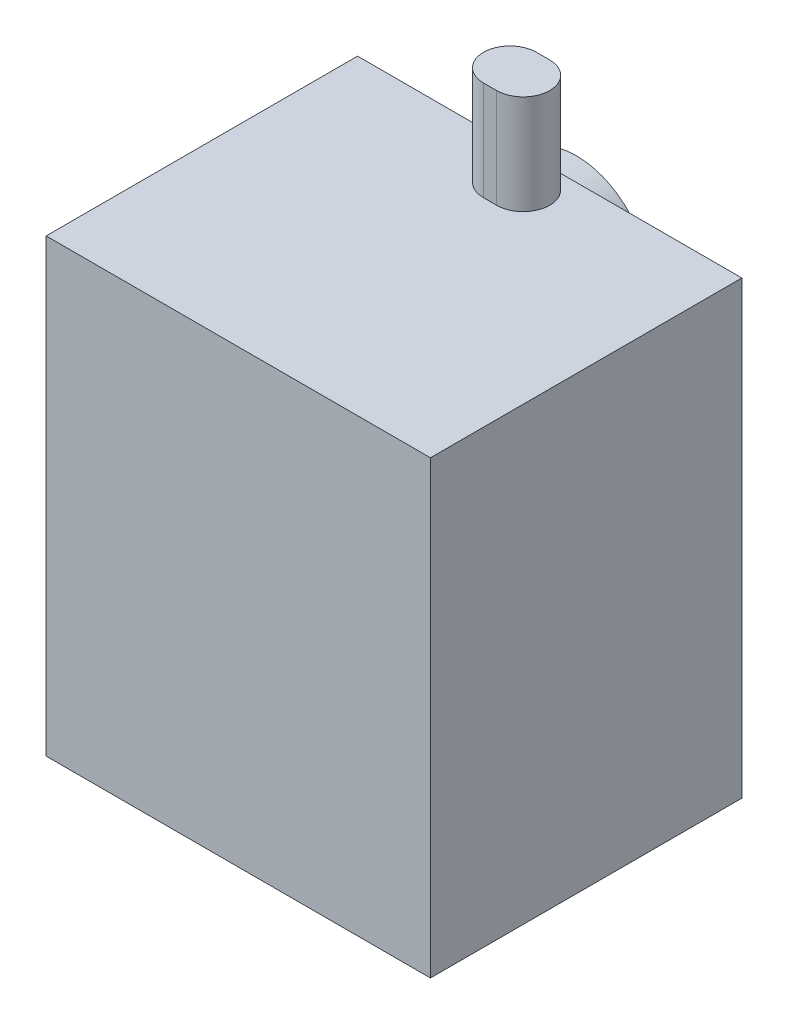
from build123d import *

# Parameters (mm, degrees)
ESBO_O1_W                = 58
ESBO_O1_H                = 68
RESSALTO_EXTRUS_O1_DEPTH = 23.5
ESBO_O2_W                = 2.557692308
ESBO_O2_H                = 0.314102564
CORTE_EXTRUS_O1_DEPTH    = 1
RESSALTO_EXTRUS_O2_DEPTH = 15
ESBO_O4_R                = 11
RESSALTO_EXTRUS_O3_DEPTH = 4


with BuildPart() as part:
    # Esboço1 → Ressalto-extrusão1 (new, symmetric)
    with BuildSketch(Plane.XY):
        Rectangle(ESBO_O1_W, ESBO_O1_H)
    extrude(amount=RESSALTO_EXTRUS_O1_DEPTH, both=True)

    # Esboço2 → Corte-extrusão1 (cut)
    # profile 1 of 13: a face of its own
    with BuildSketch(Plane(origin=(0, 0, -23.5), x_dir=(-1, 0, 0), z_dir=(0, 0, -1))):
        with BuildLine():
            add(Edge.make_bspline(
                [(12.634615385, -15.905649038), (12.63370731, -15.9251371), (12.631929126, -15.963298467), (12.616823357, -16.01853796), (12.590827583, -16.068786757), (12.557084436, -16.114021348), (12.515769317, -16.151518745), (12.46882621, -16.178406374), (12.41772133, -16.195571354), (12.382112539, -16.197656367), (12.363982372, -16.198717949)],
                knots=[0, 0, 0, 0, 1.054986045, 2.065865298, 3.074122704, 4.105114675, 5.109626121, 6.074217918, 7.019490725, 8, 8, 8, 8], degree=3))
            add(Edge.make_bspline(
                [(12.363982372, -16.198717949), (12.346322808, -16.197632619), (12.311411939, -16.19548705), (12.261193153, -16.178419063), (12.214903719, -16.151293324), (12.173669374, -16.114046306), (12.13994572, -16.068780165), (12.113944797, -16.018539704), (12.098840388, -15.963298008), (12.097062016, -15.925136945), (12.096153846, -15.905649038)],
                knots=[0, 0, 0, 0, 0.961106377, 1.899993565, 2.859409042, 3.870007927, 4.90724781, 5.921615355, 6.938620636, 8, 8, 8, 8], degree=3))
            add(Edge.make_bspline(
                [(12.096153846, -15.905649038), (12.097032849, -15.886384955), (12.098743713, -15.848889934), (12.114125508, -15.794666133), (12.139889179, -15.745225857), (12.174136064, -15.700731021), (12.214629537, -15.662745528), (12.261228119, -15.635719875), (12.311403037, -15.618606253), (12.346319817, -15.616466834), (12.363982372, -15.615384615)],
                knots=[0, 0, 0, 0, 1.055304112, 2.054011575, 3.063363921, 4.096942562, 5.122536081, 6.088009498, 7.032825006, 8, 8, 8, 8], degree=3))
            add(Edge.make_bspline(
                [(12.363982372, -15.615384615), (12.382115643, -15.61644297), (12.417730531, -15.618521646), (12.468790647, -15.635733158), (12.516045838, -15.662517326), (12.556618084, -15.700755565), (12.590884, -15.745219432), (12.616642695, -15.794667806), (12.63202579, -15.84888949), (12.633736474, -15.886384804), (12.634615385, -15.905649038)],
                knots=[0, 0, 0, 0, 0.986662878, 1.937868148, 2.908513651, 3.927890639, 4.955204348, 5.958438607, 6.951092507, 8, 8, 8, 8], degree=3))
        make_face()
    # profile 2 of 13: a face of its own
    with BuildSketch(Plane(origin=(0, 0, -23.5), x_dir=(-1, 0, 0), z_dir=(0, 0, -1))):
        with Locations((10.278846154, -15.907051282)):
            Rectangle(ESBO_O2_W, ESBO_O2_H)
    # profile 3 of 13: a face of its own
    with BuildSketch(Plane(origin=(0, 0, -23.5), x_dir=(-1, 0, 0), z_dir=(0, 0, -1))):
        with BuildLine():
            Line((11.557692308, -12.788461538), (11.557692308, -13.102564103))
            Line((11.557692308, -13.102564103), (10.371394231, -13.102564103))
            add(Edge.make_bspline(
                [(10.371394231, -13.102564103), (10.336571482, -13.102706007), (10.269957194, -13.102977465), (10.174102007, -13.104818406), (10.086685294, -13.109148499), (10.007656557, -13.114562324), (9.937029166, -13.12152446), (9.875049809, -13.129807821), (9.821015625, -13.139066242), (9.788472269, -13.148128956), (9.77333734, -13.15234375)],
                knots=[0, 0, 0, 0, 1.388932606, 2.656963016, 3.823490214, 4.879454478, 5.816252168, 6.653371382, 7.373723809, 8, 8, 8, 8], degree=3))
            add(Edge.make_bspline(
                [(9.77333734, -13.15234375), (9.754314522, -13.159105249), (9.716664366, -13.172487678), (9.66227459, -13.196760517), (9.611902173, -13.226791252), (9.563587464, -13.259642176), (9.518825676, -13.297575237), (9.477324454, -13.340035786), (9.438599671, -13.386270157), (9.391894487, -13.453994357), (9.342467449, -13.546574179), (9.299224971, -13.667850836), (9.273761575, -13.799588353), (9.270768951, -13.890745957), (9.269230769, -13.93760016)],
                knots=[0, 0, 0, 0, 0.725930277, 1.436768641, 2.137297926, 2.832005607, 3.535753883, 4.242956221, 4.964984144, 5.701683124, 7.198126434, 8.723945959, 10.316137162, 12, 12, 12, 12], degree=3))
            add(Edge.make_bspline(
                [(9.269230769, -13.93760016), (9.270763206, -13.984460301), (9.273720675, -14.074896264), (9.298840522, -14.205257317), (9.339821483, -14.324642436), (9.397828501, -14.43165769), (9.468546589, -14.525631282), (9.551561506, -14.603933726), (9.644209328, -14.668541486), (9.713333816, -14.696750839), (9.748096955, -14.7109375)],
                knots=[0, 0, 0, 0, 1.157091467, 2.233085092, 3.266839029, 4.264239195, 5.228693433, 6.160074799, 7.074690074, 8, 8, 8, 8], degree=3))
            add(Edge.make_bspline(
                [(9.748096955, -14.7109375), (9.762062957, -14.715134833), (9.792938376, -14.72441411), (9.84532423, -14.734312627), (9.907735501, -14.743598439), (9.980827619, -14.749789197), (10.06395603, -14.756854755), (10.157550626, -14.759294511), (10.261059725, -14.762778608), (10.333529294, -14.762806132), (10.371394231, -14.762820513)],
                knots=[0, 0, 0, 0, 0.557560243, 1.232629526, 2.036798082, 2.970922211, 4.03790722, 5.227863888, 6.551574656, 8, 8, 8, 8], degree=3))
            Line((10.371394231, -14.762820513), (11.557692308, -14.762820513))
            Line((11.557692308, -14.762820513), (11.557692308, -15.076923077))
            Line((11.557692308, -15.076923077), (10.3125, -15.076923077))
            add(Edge.make_bspline(
                [(10.3125, -15.076923077), (10.270192828, -15.076481383), (10.188111126, -15.075624437), (10.068827026, -15.070117079), (9.957664743, -15.060667516), (9.854565649, -15.046324664), (9.759607746, -15.029459552), (9.672671696, -15.007701413), (9.594017487, -14.981729399), (9.522291359, -14.952402962), (9.457190155, -14.917853706), (9.395768795, -14.880834424), (9.338129531, -14.839287899), (9.283989051, -14.793582089), (9.233543731, -14.743922274), (9.187013486, -14.68997668), (9.143574873, -14.632827367), (9.104077801, -14.571478033), (9.068870026, -14.505866026), (9.038173414, -14.436321459), (9.012814759, -14.36233703), (8.992079425, -14.284741521), (8.974909687, -14.202885593), (8.963400657, -14.117122195), (8.956074478, -14.027239019), (8.955448926, -13.966127551), (8.955128205, -13.934795673)],
                knots=[0, 0, 0, 0, 1.492959813, 2.896546261, 4.212934643, 5.4282803, 6.568701279, 7.614836728, 8.587629399, 9.489753423, 10.345563548, 11.185732697, 12.018869657, 12.849922188, 13.68387515, 14.5140269, 15.361852057, 16.215154979, 17.085973896, 17.987004002, 18.894652782, 19.842944701, 20.819888734, 21.843945232, 22.894589698, 24, 24, 24, 24], degree=3))
            add(Edge.make_bspline(
                [(8.955128205, -13.934795673), (8.955467912, -13.903699159), (8.956135468, -13.842591614), (8.963277276, -13.75292037), (8.975085447, -13.666971763), (8.991940664, -13.585051365), (9.012979734, -13.507076968), (9.03798327, -13.432732728), (9.069063751, -13.362889165), (9.104041309, -13.296707161), (9.143606584, -13.234704772), (9.186974624, -13.176596194), (9.234080687, -13.122459342), (9.284728044, -13.072282274), (9.33954498, -13.026769297), (9.398090541, -12.985353256), (9.459784629, -12.94739655), (9.525847792, -12.91304376), (9.598419802, -12.883532004), (9.678716899, -12.857476759), (9.767619415, -12.83616612), (9.865051344, -12.818823652), (9.970546385, -12.804872211), (10.084714801, -12.795186069), (10.207278493, -12.789770238), (10.291928383, -12.788907177), (10.335637019, -12.788461538)],
                knots=[0, 0, 0, 0, 1.083640291, 2.129454052, 3.13281866, 4.105697902, 5.042300162, 5.946461698, 6.836384745, 7.703652036, 8.553297018, 9.397182691, 10.228592656, 11.052265423, 11.879314572, 12.708807002, 13.549817954, 14.402308542, 15.300838682, 16.27712199, 17.341985831, 18.484375296, 19.725102775, 21.0496083, 22.476576903, 24, 24, 24, 24], degree=3))
            Line((10.335637019, -12.788461538), (11.557692308, -12.788461538))
        make_face()
    # profile 4 of 13: a face of its own
    with BuildSketch(Plane(origin=(0, 0, -23.5), x_dir=(-1, 0, 0), z_dir=(0, 0, -1))):
        with BuildLine():
            Line((11.557692308, -12.115384615), (8.057692308, -12.115384615))
            Line((8.057692308, -12.115384615), (8.057692308, -11.801282051))
            Line((8.057692308, -11.801282051), (9.463441506, -11.801282051))
            add(Edge.make_bspline(
                [(9.463441506, -11.801282051), (9.423211384, -11.765819734), (9.344474174, -11.696413932), (9.240732322, -11.581075935), (9.152361198, -11.459568191), (9.08054617, -11.330923449), (9.023460392, -11.196438469), (8.985022756, -11.054831755), (8.958958974, -10.907844169), (8.956415732, -10.807440389), (8.955128205, -10.756610577)],
                knots=[0, 0, 0, 0, 1.06979901, 2.093779087, 3.089483386, 4.062794046, 5.028843981, 5.997762057, 6.986359105, 8, 8, 8, 8], degree=3))
            add(Edge.make_bspline(
                [(8.955128205, -10.756610577), (8.956354374, -10.7114425), (8.958772433, -10.622369053), (8.977537663, -10.491341741), (9.007657479, -10.365242975), (9.049598139, -10.243992389), (9.10494392, -10.128411555), (9.171919959, -10.017849207), (9.25089654, -9.912047311), (9.341535176, -9.813017998), (9.439877501, -9.721710517), (9.545073941, -9.641825694), (9.655679624, -9.574120705), (9.771663464, -9.51847933), (9.892940677, -9.475421117), (10.019428064, -9.445464251), (10.150915158, -9.426719243), (10.240455063, -9.424302408), (10.285857372, -9.423076923)],
                knots=[0, 0, 0, 0, 1.034036272, 2.039165313, 3.024406509, 3.999331371, 4.971254918, 5.953351348, 6.95522652, 7.989525907, 9.023492927, 10.024309745, 11.009187477, 11.988246066, 12.964946762, 13.950187958, 14.960617622, 16, 16, 16, 16], degree=3))
            add(Edge.make_bspline(
                [(10.285857372, -9.423076923), (10.330321265, -9.424329589), (10.418223983, -9.426806043), (10.547499942, -9.445263673), (10.672028314, -9.476278399), (10.791347799, -9.519886568), (10.905938937, -9.575557531), (11.014905164, -9.644426892), (11.119913357, -9.724282929), (11.21759609, -9.816566256), (11.307499363, -9.916484393), (11.386667873, -10.02287824), (11.453472192, -10.134421172), (11.507777609, -10.251336849), (11.550931998, -10.372797403), (11.581014763, -10.499725506), (11.598698613, -10.631543941), (11.601263226, -10.721033492), (11.602564103, -10.766426282)],
                knots=[0, 0, 0, 0, 1.02050356, 2.017480486, 2.990790918, 3.96161403, 4.928589988, 5.909588639, 6.91611943, 7.952353252, 8.989586576, 9.99823133, 10.991940466, 11.968822692, 12.952985106, 13.945868367, 14.958059758, 16, 16, 16, 16], degree=3))
            add(Edge.make_bspline(
                [(11.602564103, -10.766426282), (11.601133352, -10.818628173), (11.598327716, -10.920993618), (11.574730898, -11.070916004), (11.5353558, -11.212874164), (11.481240021, -11.347686362), (11.409860859, -11.474829631), (11.319006253, -11.592739176), (11.210751775, -11.703788704), (11.127359309, -11.768152419), (11.084435096, -11.801282051)],
                knots=[0, 0, 0, 0, 1.03879612, 2.037030165, 3.012306674, 3.966139504, 4.922386257, 5.905048148, 6.921675258, 8, 8, 8, 8], degree=3))
            Line((11.084435096, -11.801282051), (11.557692308, -11.801282051))
            Line((11.557692308, -11.801282051), (11.557692308, -12.115384615))
        make_face()
        with BuildLine():
            add(Edge.make_bspline(
                [(11.288461538, -10.770633013), (11.286827918, -10.724718647), (11.283603412, -10.634090993), (11.258429663, -10.50104739), (11.216546024, -10.373732474), (11.159260529, -10.252792049), (11.087245119, -10.140102885), (11.000074446, -10.039486689), (10.900520567, -9.949739692), (10.787746484, -9.875538422), (10.668225935, -9.81297937), (10.542337959, -9.770079393), (10.413575056, -9.741532355), (10.326206752, -9.738634221), (10.282351763, -9.737179487)],
                knots=[0, 0, 0, 0, 1.031093775, 2.03521511, 3.029845951, 4.035119871, 5.034286494, 6.024708811, 7.017619509, 8.03559408, 9.050082311, 10.039808432, 11.016071318, 12, 12, 12, 12], degree=3))
            add(Edge.make_bspline(
                [(10.282351763, -9.737179487), (10.238767492, -9.739061572), (10.151769786, -9.742818363), (10.022624311, -9.769326913), (9.897243126, -9.815257244), (9.776066955, -9.876388379), (9.66306139, -9.95225404), (9.561560746, -10.041256196), (9.474040482, -10.143155433), (9.400785993, -10.256089029), (9.341819613, -10.376524204), (9.300239861, -10.503235846), (9.273984486, -10.63399759), (9.270820672, -10.723068156), (9.269230769, -10.767828526)],
                knots=[0, 0, 0, 0, 0.979154363, 1.954470772, 2.947816011, 3.971783346, 4.997163654, 5.998045606, 6.995988793, 8.00538986, 9.015323546, 10.000094788, 10.994993517, 12, 12, 12, 12], degree=3))
            add(Edge.make_bspline(
                [(9.269230769, -10.767828526), (9.270865873, -10.813280428), (9.274109662, -10.903449843), (9.299704414, -11.036806584), (9.341067285, -11.166421517), (9.399172696, -11.29036658), (9.470855123, -11.405745031), (9.555144025, -11.509167139), (9.652350119, -11.597477941), (9.760039451, -11.671510194), (9.877544377, -11.729991963), (10.003184173, -11.771239912), (10.135971494, -11.796573859), (10.226849293, -11.799690954), (10.273237179, -11.801282051)],
                knots=[0, 0, 0, 0, 1.017484689, 2.018529338, 3.030031036, 4.058138743, 5.076350332, 6.065651025, 7.036469986, 8.00785331, 8.984076697, 9.96571663, 10.961615403, 12, 12, 12, 12], degree=3))
            add(Edge.make_bspline(
                [(10.273237179, -11.801282051), (10.308574996, -11.80032238), (10.378131003, -11.798433442), (10.480258715, -11.78400309), (10.577991728, -11.76104737), (10.671437013, -11.728704087), (10.760062376, -11.686202067), (10.844562515, -11.634994762), (10.924150324, -11.574031834), (10.998725013, -11.50516854), (11.066404356, -11.42894151), (11.126056362, -11.347883942), (11.176538373, -11.262199778), (11.216937187, -11.171949161), (11.249849087, -11.07782721), (11.271586828, -10.978931782), (11.286560777, -10.876259563), (11.28782128, -10.806212575), (11.288461538, -10.770633013)],
                knots=[0, 0, 0, 0, 1.050062701, 2.066855696, 3.059271411, 4.030305351, 4.999747758, 5.975466543, 6.961907836, 7.974539719, 8.98812422, 9.98710676, 10.961662635, 11.93785114, 12.922015094, 13.919620009, 14.94329489, 16, 16, 16, 16], degree=3))
        make_face(mode=Mode.SUBTRACT)
    # profile 5 of 13: a face of its own
    with BuildSketch(Plane(origin=(0, 0, -23.5), x_dir=(-1, 0, 0), z_dir=(0, 0, -1))):
        with BuildLine():
            Line((11.557692308, -8.794871795), (9, -8.794871795))
            Line((9, -8.794871795), (9, -8.480769231))
            Line((9, -8.480769231), (9.442407853, -8.480769231))
            add(Edge.make_bspline(
                [(9.442407853, -8.480769231), (9.402357452, -8.445357846), (9.32419859, -8.376252085), (9.222394827, -8.260852099), (9.137553673, -8.139036981), (9.069666853, -8.010394809), (9.018284474, -7.875310476), (8.982150896, -7.734169208), (8.958628923, -7.587159112), (8.95630558, -7.486903296), (8.955128205, -7.436097756)],
                knots=[0, 0, 0, 0, 1.074295371, 2.096500925, 3.086030275, 4.053105238, 5.014108356, 5.985331429, 6.979048527, 8, 8, 8, 8], degree=3))
            add(Edge.make_bspline(
                [(8.955128205, -7.436097756), (8.956354374, -7.39092968), (8.958772433, -7.301856233), (8.977537663, -7.170828921), (9.007657479, -7.044730154), (9.049598139, -6.923479568), (9.10494392, -6.807898735), (9.171919959, -6.697336386), (9.25089654, -6.59153449), (9.341535176, -6.492505177), (9.439877501, -6.401197697), (9.545073941, -6.321312873), (9.655679624, -6.253607884), (9.771663464, -6.19796651), (9.892940677, -6.154908296), (10.019428064, -6.12495143), (10.150915158, -6.106206422), (10.240455063, -6.103789588), (10.285857372, -6.102564103)],
                knots=[0, 0, 0, 0, 1.034036272, 2.039165313, 3.024406509, 3.999331371, 4.971254918, 5.953351348, 6.95522652, 7.989525907, 9.023492927, 10.024309745, 11.009187477, 11.988246066, 12.964946762, 13.950187958, 14.960617622, 16, 16, 16, 16], degree=3))
            add(Edge.make_bspline(
                [(10.285857372, -6.102564103), (10.330321265, -6.103816769), (10.418223983, -6.106293222), (10.547499942, -6.124750853), (10.672028314, -6.155765578), (10.791347799, -6.199373747), (10.905938937, -6.25504471), (11.014905164, -6.323914072), (11.119913357, -6.403770109), (11.21759609, -6.496053435), (11.307499363, -6.595971573), (11.386667873, -6.70236542), (11.453472192, -6.813908352), (11.507777609, -6.930824028), (11.550931998, -7.052284583), (11.581014763, -7.179212686), (11.598698613, -7.31103112), (11.601263226, -7.400520672), (11.602564103, -7.445913462)],
                knots=[0, 0, 0, 0, 1.02050356, 2.017480486, 2.990790918, 3.96161403, 4.928589988, 5.909588639, 6.91611943, 7.952353252, 8.989586576, 9.99823133, 10.991940466, 11.968822692, 12.952985106, 13.945868367, 14.958059758, 16, 16, 16, 16], degree=3))
            add(Edge.make_bspline(
                [(11.602564103, -7.445913462), (11.601133352, -7.498115353), (11.598327716, -7.600480797), (11.574730898, -7.750403183), (11.5353558, -7.892361343), (11.481240021, -8.027173542), (11.409860859, -8.154316811), (11.319006253, -8.272226355), (11.210751775, -8.383275884), (11.127359309, -8.447639598), (11.084435096, -8.480769231)],
                knots=[0, 0, 0, 0, 1.03879612, 2.037030165, 3.012306674, 3.966139504, 4.922386257, 5.905048148, 6.921675258, 8, 8, 8, 8], degree=3))
            Line((11.084435096, -8.480769231), (11.557692308, -8.480769231))
            Line((11.557692308, -8.480769231), (11.557692308, -8.794871795))
        make_face()
        with BuildLine():
            add(Edge.make_bspline(
                [(11.288461538, -7.450120192), (11.286827918, -7.404205827), (11.283603412, -7.313578172), (11.258429663, -7.18053457), (11.216546024, -7.053219654), (11.159260529, -6.932279229), (11.087245119, -6.819590065), (11.000074446, -6.718973868), (10.900520567, -6.629226871), (10.787746484, -6.555025602), (10.668225935, -6.49246655), (10.542337959, -6.449566572), (10.413575056, -6.421019534), (10.326206752, -6.418121401), (10.282351763, -6.416666667)],
                knots=[0, 0, 0, 0, 1.031093775, 2.03521511, 3.029845951, 4.035119871, 5.034286494, 6.024708811, 7.017619509, 8.03559408, 9.050082311, 10.039808432, 11.016071318, 12, 12, 12, 12], degree=3))
            add(Edge.make_bspline(
                [(10.282351763, -6.416666667), (10.238767492, -6.418548751), (10.151769786, -6.422305543), (10.022624311, -6.448814093), (9.897243126, -6.494744423), (9.776066955, -6.555875558), (9.66306139, -6.63174122), (9.561560746, -6.720743375), (9.474040482, -6.822642612), (9.400785993, -6.935576208), (9.341819613, -7.056011384), (9.300239861, -7.182723025), (9.273984486, -7.313484769), (9.270820672, -7.402555336), (9.269230769, -7.447315705)],
                knots=[0, 0, 0, 0, 0.979154363, 1.954470772, 2.947816011, 3.971783346, 4.997163654, 5.998045606, 6.995988793, 8.00538986, 9.015323546, 10.000094788, 10.994993517, 12, 12, 12, 12], degree=3))
            add(Edge.make_bspline(
                [(9.269230769, -7.447315705), (9.270865873, -7.492767608), (9.274109662, -7.582937023), (9.299704414, -7.716293763), (9.341067285, -7.845908697), (9.399172696, -7.96985376), (9.470855123, -8.08523221), (9.555144025, -8.188654318), (9.652350119, -8.27696512), (9.760039451, -8.350997373), (9.877544377, -8.409479143), (10.003184173, -8.450727091), (10.135971494, -8.476061038), (10.226849293, -8.479178133), (10.273237179, -8.480769231)],
                knots=[0, 0, 0, 0, 1.017484689, 2.018529338, 3.030031036, 4.058138743, 5.076350332, 6.065651025, 7.036469986, 8.00785331, 8.984076697, 9.96571663, 10.961615403, 12, 12, 12, 12], degree=3))
            add(Edge.make_bspline(
                [(10.273237179, -8.480769231), (10.308574996, -8.479809559), (10.378131003, -8.477920622), (10.480258715, -8.463490269), (10.577991728, -8.440534549), (10.671437013, -8.408191267), (10.760062376, -8.365689246), (10.844562515, -8.314481941), (10.924150324, -8.253519013), (10.998725013, -8.18465572), (11.066404356, -8.10842869), (11.126056362, -8.027371122), (11.176538373, -7.941686957), (11.216937187, -7.851436341), (11.249849087, -7.757314389), (11.271586828, -7.658418962), (11.286560777, -7.555746743), (11.28782128, -7.485699755), (11.288461538, -7.450120192)],
                knots=[0, 0, 0, 0, 1.050062701, 2.066855696, 3.059271411, 4.030305351, 4.999747758, 5.975466543, 6.961907836, 7.974539719, 8.98812422, 9.98710676, 10.961662635, 11.93785114, 12.922015094, 13.919620009, 14.94329489, 16, 16, 16, 16], degree=3))
        make_face(mode=Mode.SUBTRACT)
    # profile 6 of 13: a face of its own
    with BuildSketch(Plane(origin=(0, 0, -23.5), x_dir=(-1, 0, 0), z_dir=(0, 0, -1))):
        with BuildLine():
            Line((11.557692308, -4.128205128), (9, -4.128205128))
            Line((9, -4.128205128), (9, -3.814102564))
            Line((9, -3.814102564), (9.442407853, -3.814102564))
            add(Edge.make_bspline(
                [(9.442407853, -3.814102564), (9.402357452, -3.77869118), (9.32419859, -3.709585418), (9.222394827, -3.594185432), (9.137553673, -3.472370315), (9.069666853, -3.343728142), (9.018284474, -3.208643809), (8.982150896, -3.067502541), (8.958628923, -2.920492445), (8.95630558, -2.820236629), (8.955128205, -2.76943109)],
                knots=[0, 0, 0, 0, 1.074295371, 2.096500925, 3.086030275, 4.053105238, 5.014108356, 5.985331429, 6.979048527, 8, 8, 8, 8], degree=3))
            add(Edge.make_bspline(
                [(8.955128205, -2.76943109), (8.956354374, -2.724263013), (8.958772433, -2.635189566), (8.977537663, -2.504162254), (9.007657479, -2.378063488), (9.049598139, -2.256812901), (9.10494392, -2.141232068), (9.171919959, -2.03066972), (9.25089654, -1.924867824), (9.341535176, -1.82583851), (9.439877501, -1.73453103), (9.545073941, -1.654646207), (9.655679624, -1.586941218), (9.771663464, -1.531299843), (9.892940677, -1.488241629), (10.019428064, -1.458284764), (10.150915158, -1.439539755), (10.240455063, -1.437122921), (10.285857372, -1.435897436)],
                knots=[0, 0, 0, 0, 1.034036272, 2.039165313, 3.024406509, 3.999331371, 4.971254918, 5.953351348, 6.95522652, 7.989525907, 9.023492927, 10.024309745, 11.009187477, 11.988246066, 12.964946762, 13.950187958, 14.960617622, 16, 16, 16, 16], degree=3))
            add(Edge.make_bspline(
                [(10.285857372, -1.435897436), (10.330321265, -1.437150102), (10.418223983, -1.439626556), (10.547499942, -1.458084186), (10.672028314, -1.489098912), (10.791347799, -1.532707081), (10.905938937, -1.588378044), (11.014905164, -1.657247405), (11.119913357, -1.737103442), (11.21759609, -1.829386769), (11.307499363, -1.929304906), (11.386667873, -2.035698753), (11.453472192, -2.147241685), (11.507777609, -2.264157362), (11.550931998, -2.385617916), (11.581014763, -2.512546019), (11.598698613, -2.644364454), (11.601263226, -2.733854005), (11.602564103, -2.779246795)],
                knots=[0, 0, 0, 0, 1.02050356, 2.017480486, 2.990790918, 3.96161403, 4.928589988, 5.909588639, 6.91611943, 7.952353252, 8.989586576, 9.99823133, 10.991940466, 11.968822692, 12.952985106, 13.945868367, 14.958059758, 16, 16, 16, 16], degree=3))
            add(Edge.make_bspline(
                [(11.602564103, -2.779246795), (11.601133352, -2.831448686), (11.598327716, -2.93381413), (11.574730898, -3.083736517), (11.5353558, -3.225694676), (11.481240021, -3.360506875), (11.409860859, -3.487650144), (11.319006253, -3.605559688), (11.210751775, -3.716609217), (11.127359309, -3.780972931), (11.084435096, -3.814102564)],
                knots=[0, 0, 0, 0, 1.03879612, 2.037030165, 3.012306674, 3.966139504, 4.922386257, 5.905048148, 6.921675258, 8, 8, 8, 8], degree=3))
            Line((11.084435096, -3.814102564), (11.557692308, -3.814102564))
            Line((11.557692308, -3.814102564), (11.557692308, -4.128205128))
        make_face()
        with BuildLine():
            add(Edge.make_bspline(
                [(11.288461538, -2.783453526), (11.286827918, -2.73753916), (11.283603412, -2.646911506), (11.258429663, -2.513867903), (11.216546024, -2.386552987), (11.159260529, -2.265612562), (11.087245119, -2.152923398), (11.000074446, -2.052307201), (10.900520567, -1.962560204), (10.787746484, -1.888358935), (10.668225935, -1.825799883), (10.542337959, -1.782899905), (10.413575056, -1.754352868), (10.326206752, -1.751454734), (10.282351763, -1.75)],
                knots=[0, 0, 0, 0, 1.031093775, 2.03521511, 3.029845951, 4.035119871, 5.034286494, 6.024708811, 7.017619509, 8.03559408, 9.050082311, 10.039808432, 11.016071318, 12, 12, 12, 12], degree=3))
            add(Edge.make_bspline(
                [(10.282351763, -1.75), (10.238767492, -1.751882084), (10.151769786, -1.755638876), (10.022624311, -1.782147426), (9.897243126, -1.828077757), (9.776066955, -1.889208892), (9.66306139, -1.965074553), (9.561560746, -2.054076708), (9.474040482, -2.155975945), (9.400785993, -2.268909541), (9.341819613, -2.389344717), (9.300239861, -2.516056358), (9.273984486, -2.646818103), (9.270820672, -2.735888669), (9.269230769, -2.780649038)],
                knots=[0, 0, 0, 0, 0.979154363, 1.954470772, 2.947816011, 3.971783346, 4.997163654, 5.998045606, 6.995988793, 8.00538986, 9.015323546, 10.000094788, 10.994993517, 12, 12, 12, 12], degree=3))
            add(Edge.make_bspline(
                [(9.269230769, -2.780649038), (9.270865873, -2.826100941), (9.274109662, -2.916270356), (9.299704414, -3.049627097), (9.341067285, -3.17924203), (9.399172696, -3.303187093), (9.470855123, -3.418565544), (9.555144025, -3.521987652), (9.652350119, -3.610298454), (9.760039451, -3.684330707), (9.877544377, -3.742812476), (10.003184173, -3.784060425), (10.135971494, -3.809394372), (10.226849293, -3.812511466), (10.273237179, -3.814102564)],
                knots=[0, 0, 0, 0, 1.017484689, 2.018529338, 3.030031036, 4.058138743, 5.076350332, 6.065651025, 7.036469986, 8.00785331, 8.984076697, 9.96571663, 10.961615403, 12, 12, 12, 12], degree=3))
            add(Edge.make_bspline(
                [(10.273237179, -3.814102564), (10.308574996, -3.813142893), (10.378131003, -3.811253955), (10.480258715, -3.796823602), (10.577991728, -3.773867883), (10.671437013, -3.7415246), (10.760062376, -3.69902258), (10.844562515, -3.647815275), (10.924150324, -3.586852347), (10.998725013, -3.517989053), (11.066404356, -3.441762023), (11.126056362, -3.360704455), (11.176538373, -3.275020291), (11.216937187, -3.184769674), (11.249849087, -3.090647723), (11.271586828, -2.991752295), (11.286560777, -2.889080076), (11.28782128, -2.819033088), (11.288461538, -2.783453526)],
                knots=[0, 0, 0, 0, 1.050062701, 2.066855696, 3.059271411, 4.030305351, 4.999747758, 5.975466543, 6.961907836, 7.974539719, 8.98812422, 9.98710676, 10.961662635, 11.93785114, 12.922015094, 13.919620009, 14.94329489, 16, 16, 16, 16], degree=3))
        make_face(mode=Mode.SUBTRACT)
    # profile 7 of 13: a face of its own
    with BuildSketch(Plane(origin=(0, 0, -23.5), x_dir=(-1, 0, 0), z_dir=(0, 0, -1))):
        Polygon((12.679487179, -2.965044071), (12.679487179, -3.455128205), (11.961538462, -2.782752404), (11.961538462, -2.467948718), align=None)
    # profile 8 of 13: a face of its own
    with BuildSketch(Plane(origin=(0, 0, -23.5), x_dir=(-1, 0, 0), z_dir=(0, 0, -1))):
        Polygon((12.58974359, -0.179487179), (12.58974359, -0.493589744), (11.557692308, -0.493589744), (11.557692308, -0.942307692), (11.243589744, -0.942307692), (11.243589744, -0.493589744), (9, -0.493589744), (9, -0.179487179), (11.243589744, -0.179487179), (11.243589744, 0.269230769), (11.557692308, 0.269230769), (11.557692308, -0.179487179), align=None)
    # profile 9 of 13: a face of its own
    with BuildSketch(Plane(origin=(0, 0, -23.5), x_dir=(-1, 0, 0), z_dir=(0, 0, -1))):
        with BuildLine():
            Line((11.238681891, 0.807692308), (11.019230769, 1.020833333))
            add(Edge.make_bspline(
                [(11.019230769, 1.020833333), (11.040548523, 1.03922082), (11.081646644, 1.074669729), (11.136522231, 1.130941466), (11.182990263, 1.186977226), (11.221225502, 1.242481462), (11.251316988, 1.297557752), (11.272570288, 1.352676344), (11.285913033, 1.407685985), (11.287622239, 1.444474972), (11.288461538, 1.462540064)],
                knots=[0, 0, 0, 0, 1.265880991, 2.440469525, 3.530740057, 4.536711111, 5.468008477, 6.34654737, 7.188078389, 8, 8, 8, 8], degree=3))
            add(Edge.make_bspline(
                [(11.288461538, 1.462540064), (11.287376181, 1.484673269), (11.285240351, 1.528228284), (11.264344046, 1.590549139), (11.231498561, 1.647998991), (11.185841467, 1.698154849), (11.132806978, 1.740412881), (11.074229729, 1.772442096), (11.01054531, 1.79119776), (10.966533213, 1.793635433), (10.944210737, 1.794871795)],
                knots=[0, 0, 0, 0, 1.000196853, 1.968245854, 2.94569445, 3.981000421, 5.021494845, 6.007172807, 6.989258906, 8, 8, 8, 8], degree=3))
            add(Edge.make_bspline(
                [(10.944210737, 1.794871795), (10.923998693, 1.793760983), (10.883631582, 1.791542489), (10.824083548, 1.77429581), (10.76602651, 1.746829738), (10.730463604, 1.721159544), (10.712139423, 1.707932692)],
                knots=[0, 0, 0, 0, 0.960159726, 1.917612774, 2.927026955, 4, 4, 4, 4], degree=3))
            add(Edge.make_bspline(
                [(10.712139423, 1.707932692), (10.702354839, 1.699969199), (10.681529584, 1.683019906), (10.652625731, 1.651211391), (10.62068348, 1.615188888), (10.588746643, 1.57186895), (10.555114918, 1.523117922), (10.521112785, 1.467878638), (10.48414836, 1.407904133), (10.460703924, 1.364966826), (10.448517628, 1.342648237)],
                knots=[0, 0, 0, 0, 0.66740084, 1.420478572, 2.27185888, 3.217733974, 4.268547843, 5.408967954, 6.65319498, 8, 8, 8, 8], degree=3))
            add(Edge.make_bspline(
                [(10.448517628, 1.342648237), (10.433272725, 1.31543466), (10.403824593, 1.26286699), (10.358114889, 1.188174223), (10.312683465, 1.120387182), (10.268016191, 1.058931514), (10.222863324, 1.004989705), (10.178955567, 0.956925153), (10.134966258, 0.915936709), (10.104233145, 0.892982782), (10.089543269, 0.882011218)],
                knots=[0, 0, 0, 0, 1.27191281, 2.456916733, 3.569705269, 4.599008579, 5.553216877, 6.436649441, 7.252746552, 8, 8, 8, 8], degree=3))
            add(Edge.make_bspline(
                [(10.089543269, 0.882011218), (10.059909466, 0.863709413), (10.00100518, 0.82733019), (9.903351967, 0.790617663), (9.800629714, 0.767152321), (9.729999555, 0.764280008), (9.694110577, 0.762820513)],
                knots=[0, 0, 0, 0, 0.995606783, 1.979007074, 2.973082153, 4, 4, 4, 4], degree=3))
            add(Edge.make_bspline(
                [(9.694110577, 0.762820513), (9.668840613, 0.763538396), (9.619043389, 0.764953062), (9.545720292, 0.774834824), (9.475542604, 0.791702691), (9.408099681, 0.815082444), (9.343522979, 0.845063411), (9.282298951, 0.882744626), (9.223907606, 0.926434221), (9.168677169, 0.97587608), (9.118568111, 1.030788957), (9.074973865, 1.089837095), (9.038155825, 1.15213124), (9.007930161, 1.217686584), (8.983851093, 1.286642463), (8.967191533, 1.359055889), (8.957217963, 1.434684062), (8.955833599, 1.486113951), (8.955128205, 1.512319712)],
                knots=[0, 0, 0, 0, 1.032633728, 2.034917567, 3.017159222, 3.977707287, 4.947659047, 5.920662675, 6.910168127, 7.92466491, 8.94557085, 9.942744688, 10.919024275, 11.897637117, 12.88838639, 13.898512555, 14.929200919, 16, 16, 16, 16], degree=3))
            add(Edge.make_bspline(
                [(8.955128205, 1.512319712), (8.956120905, 1.547686887), (8.958092513, 1.617929814), (8.976598574, 1.721819533), (9.005393968, 1.823340292), (9.045109902, 1.921723832), (9.095260615, 2.014769946), (9.155323008, 2.099900871), (9.223313006, 2.177412333), (9.275425916, 2.221530607), (9.301482372, 2.243589744)],
                knots=[0, 0, 0, 0, 1.013940152, 2.01379169, 3.017749504, 4.037548394, 5.051665909, 6.043208538, 7.021604269, 8, 8, 8, 8], degree=3))
            Line((9.301482372, 2.243589744), (9.538461538, 2.035356571))
            add(Edge.make_bspline(
                [(9.538461538, 2.035356571), (9.517106774, 2.015584158), (9.475707334, 1.977252345), (9.420582993, 1.915951129), (9.374381722, 1.853571727), (9.335738307, 1.790737041), (9.305962904, 1.726516947), (9.28504431, 1.661271332), (9.271600118, 1.595132908), (9.270021836, 1.550710772), (9.269230769, 1.528445513)],
                knots=[0, 0, 0, 0, 1.179806542, 2.287233372, 3.337373186, 4.324005949, 5.273901747, 6.200048787, 7.097828587, 8, 8, 8, 8], degree=3))
            add(Edge.make_bspline(
                [(9.269230769, 1.528445513), (9.270601594, 1.498127587), (9.273279956, 1.438891445), (9.297597048, 1.354047687), (9.335727, 1.27570906), (9.389811698, 1.207685715), (9.452767271, 1.149783554), (9.52368139, 1.107855379), (9.600472847, 1.081579204), (9.653705149, 1.078493205), (9.680789263, 1.076923077)],
                knots=[0, 0, 0, 0, 1.072336372, 2.095165389, 3.102688358, 4.141489647, 5.156069229, 6.117746104, 7.042326257, 8, 8, 8, 8], degree=3))
            add(Edge.make_bspline(
                [(9.680789263, 1.076923077), (9.703098881, 1.078009371), (9.747146237, 1.080154114), (9.810896578, 1.096997386), (9.871365859, 1.123610238), (9.906755506, 1.149814887), (9.924779647, 1.163161058)],
                knots=[0, 0, 0, 0, 1.013901739, 2.00181326, 2.98231254, 4, 4, 4, 4], degree=3))
            add(Edge.make_bspline(
                [(9.924779647, 1.163161058), (9.93381501, 1.171183452), (9.953497292, 1.188659125), (9.98192237, 1.220714366), (10.01256047, 1.259096228), (10.044892059, 1.304236391), (10.078490664, 1.356225853), (10.113180016, 1.415275328), (10.150607742, 1.480575881), (10.175427397, 1.526746512), (10.188401442, 1.55088141)],
                knots=[0, 0, 0, 0, 0.615000592, 1.339693406, 2.178160186, 3.116406724, 4.166410947, 5.330106347, 6.604359322, 8, 8, 8, 8], degree=3))
            add(Edge.make_bspline(
                [(10.188401442, 1.55088141), (10.202940574, 1.57692805), (10.23113659, 1.627440798), (10.275052671, 1.698988089), (10.319719945, 1.763535443), (10.362632784, 1.822636018), (10.406053728, 1.874797023), (10.45003098, 1.919812971), (10.492790966, 1.959456187), (10.523088263, 1.981403599), (10.537560096, 1.991887019)],
                knots=[0, 0, 0, 0, 1.262093308, 2.447601706, 3.550203992, 4.582594899, 5.537233252, 6.418365656, 7.244515135, 8, 8, 8, 8], degree=3))
            add(Edge.make_bspline(
                [(10.537560096, 1.991887019), (10.566705711, 2.010017619), (10.625007126, 2.046285154), (10.722317603, 2.081500345), (10.824762661, 2.105706374), (10.895449515, 2.107868764), (10.931590545, 2.108974359)],
                knots=[0, 0, 0, 0, 0.985009483, 1.970363186, 2.962279964, 4, 4, 4, 4], degree=3))
            add(Edge.make_bspline(
                [(10.931590545, 2.108974359), (10.955215889, 2.108440086), (11.001454035, 2.107394439), (11.069393613, 2.099051476), (11.133939, 2.083855791), (11.196075886, 2.064815264), (11.2545413, 2.038279581), (11.310454167, 2.00676366), (11.362769164, 1.968732073), (11.411747706, 1.925984057), (11.456698919, 1.879512102), (11.49524325, 1.82861432), (11.528389265, 1.775112272), (11.556143863, 1.718694209), (11.577148114, 1.658876355), (11.591604713, 1.596061251), (11.601260131, 1.530380293), (11.602123186, 1.48547914), (11.602564103, 1.462540064)],
                knots=[0, 0, 0, 0, 1.087761869, 2.12890409, 3.144425528, 4.138218063, 5.116152125, 6.094559764, 7.089109474, 8.088306095, 9.085414286, 10.060442677, 11.0220762, 11.979848209, 12.949875201, 13.933947973, 14.944496518, 16, 16, 16, 16], degree=3))
            add(Edge.make_bspline(
                [(11.602564103, 1.462540064), (11.601462347, 1.435346666), (11.599238168, 1.38044975), (11.581492152, 1.29811594), (11.552592355, 1.21599668), (11.511740715, 1.134007806), (11.460358873, 1.051800009), (11.39711483, 0.969741775), (11.323793795, 0.886499914), (11.267686429, 0.834548459), (11.238681891, 0.807692308)],
                knots=[0, 0, 0, 0, 0.845753203, 1.707371858, 2.609134499, 3.549244224, 4.552329203, 5.621587647, 6.770486714, 8, 8, 8, 8], degree=3))
        make_face()
    # profile 10 of 13: a face of its own
    with BuildSketch(Plane(origin=(0, 0, -23.5), x_dir=(-1, 0, 0), z_dir=(0, 0, -1))):
        with BuildLine():
            Line((9.807692308, 3.061097756), (9.661157853, 2.782051282))
            add(Edge.make_bspline(
                [(9.661157853, 2.782051282), (9.621717748, 2.804291076), (9.544982922, 2.847560908), (9.439506625, 2.921917598), (9.344945515, 2.999958555), (9.262763448, 3.084375375), (9.191510673, 3.174128345), (9.12958093, 3.269349307), (9.076225637, 3.369720076), (9.031512402, 3.475594469), (8.997092053, 3.587887206), (8.972790891, 3.706910642), (8.957766764, 3.832881599), (8.956021744, 3.919227855), (8.955128205, 3.963441506)],
                knots=[0, 0, 0, 0, 1.120373846, 2.179803828, 3.190307243, 4.151866639, 5.090753574, 6.023181945, 6.960194942, 7.901556876, 8.864247182, 9.862852693, 10.905672442, 12, 12, 12, 12], degree=3))
            add(Edge.make_bspline(
                [(8.955128205, 3.963441506), (8.956275381, 4.012583484), (8.958513187, 4.108445245), (8.977805651, 4.247984995), (9.009278014, 4.379364403), (9.05324354, 4.502576145), (9.11067092, 4.617318257), (9.180630192, 4.723819634), (9.262763243, 4.822637182), (9.35777666, 4.910668901), (9.459469847, 4.98988492), (9.565385142, 5.059911452), (9.675576409, 5.118046844), (9.788329966, 5.166935982), (9.904683472, 5.203977517), (10.02399923, 5.231091988), (10.146868461, 5.246424079), (10.229961229, 5.248801782), (10.271834936, 5.25)],
                knots=[0, 0, 0, 0, 1.145226127, 2.234004399, 3.276654467, 4.290038057, 5.276870678, 6.260645262, 7.254731018, 8.264593254, 9.273837991, 10.257612574, 11.220387342, 12.174754112, 13.118989047, 14.062768009, 15.023752772, 16, 16, 16, 16], degree=3))
            add(Edge.make_bspline(
                [(10.271834936, 5.25), (10.311129766, 5.248940859), (10.389006931, 5.24684178), (10.504272476, 5.233610993), (10.616300928, 5.2101627), (10.725185376, 5.177986376), (10.83074351, 5.13643513), (10.933039574, 5.085602911), (11.031964713, 5.025410533), (11.094367847, 4.978937859), (11.125801282, 4.955528846)],
                knots=[0, 0, 0, 0, 1.024358464, 2.0301432, 3.019427413, 4.004406732, 4.986367066, 5.972626655, 6.978780325, 8, 8, 8, 8], degree=3))
            add(Edge.make_bspline(
                [(11.125801282, 4.955528846), (11.163670152, 4.923821163), (11.238208303, 4.861410217), (11.336146628, 4.755853861), (11.418190404, 4.641553665), (11.48619754, 4.519942039), (11.537871187, 4.389605565), (11.576378769, 4.252296274), (11.59795678, 4.106450688), (11.601004614, 4.006745467), (11.602564103, 3.955729167)],
                knots=[0, 0, 0, 0, 1.030682036, 2.02871468, 2.997146059, 3.962720338, 4.930598197, 5.918074684, 6.934738563, 8, 8, 8, 8], degree=3))
            add(Edge.make_bspline(
                [(11.602564103, 3.955729167), (11.601210054, 3.903281561), (11.598553718, 3.800391315), (11.573927385, 3.650359194), (11.53487483, 3.508398478), (11.47972104, 3.374565974), (11.408561488, 3.248848113), (11.320419647, 3.132062063), (11.218001559, 3.022210551), (11.13923835, 2.958301972), (11.099158654, 2.92578125)],
                knots=[0, 0, 0, 0, 1.056321875, 2.072262726, 3.055038591, 4.01806755, 4.982017516, 5.957941055, 6.960871419, 8, 8, 8, 8], degree=3))
            add(Edge.make_bspline(
                [(11.099158654, 2.92578125), (11.068955072, 2.903654312), (11.008748954, 2.859547719), (10.910577797, 2.804300619), (10.807867202, 2.756343224), (10.698956905, 2.718010263), (10.585137325, 2.686970761), (10.46559478, 2.664513943), (10.340364869, 2.651344324), (10.255038314, 2.648755627), (10.211538462, 2.647435897)],
                knots=[0, 0, 0, 0, 0.94817472, 1.890038105, 2.849395472, 3.817997239, 4.812318967, 5.836947057, 6.897266129, 8, 8, 8, 8], degree=3))
            Line((10.211538462, 2.647435897), (10.211538462, 4.935897436))
            add(Edge.make_bspline(
                [(10.211538462, 4.935897436), (10.177838679, 4.934356367), (10.111569416, 4.931325918), (10.014588944, 4.917231556), (9.922250709, 4.894907478), (9.834948141, 4.863876362), (9.752394597, 4.824966544), (9.674021127, 4.77880115), (9.60101798, 4.72338804), (9.532439129, 4.661683446), (9.471389686, 4.592966943), (9.416705244, 4.520700337), (9.371125606, 4.443935113), (9.333571491, 4.363445131), (9.304667328, 4.278812965), (9.284762939, 4.190157629), (9.271465805, 4.097754915), (9.269984763, 4.034769816), (9.269230769, 4.002704327)],
                knots=[0, 0, 0, 0, 1.094405546, 2.152104367, 3.174987145, 4.173015398, 5.153654967, 6.133208507, 7.119289451, 8.123438607, 9.122504012, 10.097966803, 11.060604936, 12.014205423, 12.976096155, 13.956823727, 14.959826266, 16, 16, 16, 16], degree=3))
            add(Edge.make_bspline(
                [(9.269230769, 4.002704327), (9.269834597, 3.971352381), (9.271032708, 3.909144106), (9.282855869, 3.816287581), (9.301660469, 3.724883454), (9.327506579, 3.63558823), (9.359345811, 3.55034342), (9.397510815, 3.471172208), (9.439245837, 3.397807875), (9.487729871, 3.329635113), (9.546460461, 3.263510122), (9.620590566, 3.198740268), (9.707363487, 3.128352788), (9.772938293, 3.084394974), (9.807692308, 3.061097756)],
                knots=[0, 0, 0, 0, 0.990963276, 1.966261236, 2.95471375, 3.93937425, 4.902926125, 5.828461241, 6.715766441, 7.568835615, 8.469155523, 9.505141836, 10.677749234, 12, 12, 12, 12], degree=3))
        make_face()
        with BuildLine():
            add(Edge.make_bspline(
                [(10.525641026, 2.961538462), (10.567313968, 2.97301548), (10.647520968, 2.995105046), (10.758326233, 3.041558803), (10.857374255, 3.092685846), (10.943029607, 3.154396777), (11.01857323, 3.224920356), (11.085258067, 3.305518814), (11.144629189, 3.396002444), (11.194794866, 3.495748007), (11.237481081, 3.601393546), (11.266107172, 3.711998733), (11.285716458, 3.824856785), (11.287542601, 3.901191036), (11.288461538, 3.939603365)],
                knots=[0, 0, 0, 0, 1.154756201, 2.222533969, 3.206705588, 4.129403772, 5.035894089, 5.963342549, 6.920206228, 7.923656548, 8.944970878, 9.96070521, 10.973801891, 12, 12, 12, 12], degree=3))
            add(Edge.make_bspline(
                [(11.288461538, 3.939603365), (11.287847285, 3.970951936), (11.286633036, 4.032921469), (11.275200207, 4.124235078), (11.256056127, 4.212087127), (11.230561187, 4.296961338), (11.195434326, 4.377380383), (11.15508197, 4.455437043), (11.105505159, 4.529203229), (11.0677511, 4.575346459), (11.048677885, 4.598657853)],
                knots=[0, 0, 0, 0, 1.048700258, 2.073059931, 3.073189922, 4.055269162, 5.032885305, 6.005420607, 6.992345662, 8, 8, 8, 8], degree=3))
            add(Edge.make_bspline(
                [(11.048677885, 4.598657853), (11.033583569, 4.615351135), (11.003036353, 4.649134269), (10.950407146, 4.69427479), (10.893655584, 4.737495263), (10.83061046, 4.776828916), (10.761989681, 4.812906502), (10.688372045, 4.846666479), (10.609198915, 4.877052891), (10.554026476, 4.894149001), (10.525641026, 4.902944712)],
                knots=[0, 0, 0, 0, 0.879870761, 1.780643979, 2.707998968, 3.669668524, 4.684282772, 5.740141944, 6.837334558, 8, 8, 8, 8], degree=3))
            Line((10.525641026, 4.902944712), (10.525641026, 2.961538462))
        make_face(mode=Mode.SUBTRACT)
    # profile 11 of 13: a face of its own
    with BuildSketch(Plane(origin=(0, 0, -23.5), x_dir=(-1, 0, 0), z_dir=(0, 0, -1))):
        with BuildLine():
            Line((9.675180288, 9.198717949), (9.852564103, 8.902844551))
            add(Edge.make_bspline(
                [(9.852564103, 8.902844551), (9.806499718, 8.875326314), (9.718242134, 8.822602433), (9.598984093, 8.734651074), (9.497621937, 8.643518163), (9.414745329, 8.54852883), (9.349496442, 8.450262881), (9.303294211, 8.348078828), (9.274478235, 8.242321017), (9.270978149, 8.170347195), (9.269230769, 8.134415064)],
                knots=[0, 0, 0, 0, 1.272034388, 2.437168799, 3.508375237, 4.49857839, 5.41946034, 6.295179144, 7.148887113, 8, 8, 8, 8], degree=3))
            add(Edge.make_bspline(
                [(9.269230769, 8.134415064), (9.270085441, 8.1037282), (9.271779829, 8.042891421), (9.288060647, 7.953329224), (9.313072716, 7.866347247), (9.348893869, 7.783739265), (9.392231555, 7.706641283), (9.444580544, 7.639042907), (9.503176771, 7.580567272), (9.568595717, 7.532865526), (9.63870863, 7.495834352), (9.711319991, 7.46903757), (9.786110405, 7.45198303), (9.836816049, 7.449812329), (9.862379808, 7.448717949)],
                knots=[0, 0, 0, 0, 1.095270387, 2.171376115, 3.241375676, 4.322296363, 5.380636668, 6.392615365, 7.366724986, 8.328592944, 9.273498763, 10.190095884, 11.087518669, 12, 12, 12, 12], degree=3))
            add(Edge.make_bspline(
                [(9.862379808, 7.448717949), (9.891520657, 7.450192259), (9.950759747, 7.453189318), (10.0381594, 7.478520798), (10.12465197, 7.518370045), (10.178153235, 7.555132688), (10.205929487, 7.57421875)],
                knots=[0, 0, 0, 0, 0.938893495, 1.908633276, 2.914225137, 4, 4, 4, 4], degree=3))
            add(Edge.make_bspline(
                [(10.205929487, 7.57421875), (10.226017291, 7.589845001), (10.268312913, 7.622746656), (10.330218384, 7.680093344), (10.395634226, 7.745635066), (10.464294802, 7.819699482), (10.534946198, 7.903758839), (10.609061151, 7.996087081), (10.686416915, 8.097162153), (10.737571527, 8.168395296), (10.764022436, 8.205228365)],
                knots=[0, 0, 0, 0, 0.72226686, 1.520759855, 2.393439377, 3.351307446, 4.386958158, 5.510256019, 6.712608938, 8, 8, 8, 8], degree=3))
            add(Edge.make_bspline(
                [(10.764022436, 8.205228365), (10.790257027, 8.24204745), (10.840415567, 8.312442735), (10.914762239, 8.410964819), (10.983169392, 8.498947129), (11.044684139, 8.576837978), (11.101989442, 8.642622232), (11.152014057, 8.69870478), (11.197429242, 8.743016522), (11.226867212, 8.767674962), (11.240084135, 8.778745994)],
                knots=[0, 0, 0, 0, 1.452255772, 2.776602448, 3.96446981, 5.032613149, 5.964194703, 6.766668629, 7.446264616, 8, 8, 8, 8], degree=3))
            add(Edge.make_bspline(
                [(11.240084135, 8.778745994), (11.260685171, 8.794218539), (11.301199875, 8.824647376), (11.364524733, 8.864813381), (11.429347998, 8.898952544), (11.495843863, 8.925714876), (11.563078792, 8.948251095), (11.631930038, 8.963409025), (11.702088656, 8.972900422), (11.749302157, 8.973872409), (11.772936699, 8.974358974)],
                knots=[0, 0, 0, 0, 1.068054152, 2.10047183, 3.106115577, 4.101338837, 5.06977816, 6.043150881, 7.020423561, 8, 8, 8, 8], degree=3))
            add(Edge.make_bspline(
                [(11.772936699, 8.974358974), (11.809969574, 8.973059459), (11.883243772, 8.970488204), (11.990229619, 8.948565083), (12.092684247, 8.914366462), (12.188350891, 8.864905244), (12.277005834, 8.803752864), (12.357294574, 8.731480357), (12.425365503, 8.645672664), (12.484150669, 8.55100008), (12.530564015, 8.448042383), (12.565761611, 8.3403484), (12.585439222, 8.227445889), (12.588294703, 8.150846253), (12.58974359, 8.111979167)],
                knots=[0, 0, 0, 0, 1.005541892, 1.989591032, 2.955705311, 3.932863626, 4.905387107, 5.876519979, 6.856563935, 7.871847665, 8.897921447, 9.918317993, 10.943742853, 12, 12, 12, 12], degree=3))
            add(Edge.make_bspline(
                [(12.58974359, 8.111979167), (12.588347686, 8.070728918), (12.585579443, 7.988924744), (12.560648427, 7.868368697), (12.520376942, 7.752074925), (12.47399396, 7.658464138), (12.427876069, 7.585327011), (12.385853249, 7.529555245), (12.33747903, 7.473037507), (12.282619521, 7.415319537), (12.220772848, 7.357378853), (12.152362136, 7.298355408), (12.077805587, 7.238111137), (12.024581085, 7.199355277), (11.997295673, 7.179487179)],
                knots=[0, 0, 0, 0, 1.286821612, 2.551921131, 3.825787379, 5.12137259, 5.803616487, 6.523126609, 7.299589446, 8.125436757, 9.008162487, 9.944516264, 10.946261234, 12, 12, 12, 12], degree=3))
            Line((11.997295673, 7.179487179), (11.782051282, 7.463441506))
            add(Edge.make_bspline(
                [(11.782051282, 7.463441506), (11.804139973, 7.480587439), (11.846677627, 7.513606495), (11.906248935, 7.563735985), (11.960665442, 7.610984624), (12.007930479, 7.657535053), (12.050632911, 7.700928589), (12.087191686, 7.743045944), (12.11797047, 7.78327928), (12.150800721, 7.834000428), (12.183551326, 7.89788599), (12.210674418, 7.978001743), (12.227560433, 8.061496828), (12.229687874, 8.118209018), (12.230769231, 8.147035256)],
                knots=[0, 0, 0, 0, 1.181667846, 2.275615987, 3.290305621, 4.226321945, 5.078535498, 5.862783384, 6.581873284, 7.217493746, 8.414623899, 9.604724551, 10.782505457, 12, 12, 12, 12], degree=3))
            add(Edge.make_bspline(
                [(12.230769231, 8.147035256), (12.229557531, 8.183191779), (12.227220882, 8.252916226), (12.201700896, 8.351906462), (12.161519036, 8.441000387), (12.105204058, 8.517552952), (12.038483065, 8.58128993), (11.96170421, 8.627395388), (11.876921808, 8.655145553), (11.817780151, 8.658531832), (11.787660256, 8.66025641)],
                knots=[0, 0, 0, 0, 1.14458467, 2.207223713, 3.21896685, 4.227309161, 5.202851033, 6.127160689, 7.046193047, 8, 8, 8, 8], degree=3))
            add(Edge.make_bspline(
                [(11.787660256, 8.66025641), (11.768913559, 8.659844982), (11.731389509, 8.659021453), (11.675804871, 8.64831058), (11.620713639, 8.633122883), (11.565870844, 8.610894754), (11.509986268, 8.580954462), (11.453210792, 8.540244665), (11.394110972, 8.489315034), (11.355710822, 8.450225458), (11.335436699, 8.42958734)],
                knots=[0, 0, 0, 0, 0.858526328, 1.718456515, 2.587092892, 3.476767204, 4.426280253, 5.487868114, 6.673670035, 8, 8, 8, 8], degree=3))
            add(Edge.make_bspline(
                [(11.335436699, 8.42958734), (11.328599673, 8.421925967), (11.312356465, 8.4037243), (11.285764184, 8.370448374), (11.252961412, 8.326505576), (11.212374095, 8.273043375), (11.165292633, 8.209076013), (11.112319021, 8.134596457), (11.051733562, 8.050434924), (11.009376021, 7.990713008), (10.986979167, 7.959134615)],
                knots=[0, 0, 0, 0, 0.420754252, 0.999615792, 1.744751191, 2.668019286, 3.750313428, 4.999500688, 6.413464383, 8, 8, 8, 8], degree=3))
            add(Edge.make_bspline(
                [(10.986979167, 7.959134615), (10.959337807, 7.921148702), (10.905814145, 7.847594246), (10.825398465, 7.742936666), (10.746750697, 7.648042858), (10.67037309, 7.562579654), (10.596844997, 7.485702746), (10.525281816, 7.418265025), (10.456196244, 7.359579345), (10.367623668, 7.296400126), (10.258842584, 7.231842307), (10.125564345, 7.176400799), (9.991768025, 7.141442452), (9.901841188, 7.136870936), (9.857471955, 7.134615385)],
                knots=[0, 0, 0, 0, 1.163667725, 2.253281268, 3.268753668, 4.215851969, 5.092017293, 5.902905408, 6.650798638, 7.335211899, 8.59617414, 9.77448103, 10.901945474, 12, 12, 12, 12], degree=3))
            add(Edge.make_bspline(
                [(9.857471955, 7.134615385), (9.826093837, 7.135272888), (9.763946944, 7.136575126), (9.67268827, 7.151530731), (9.584070778, 7.173470139), (9.499109563, 7.206433435), (9.416667774, 7.246981403), (9.337504814, 7.297063964), (9.262708929, 7.357438459), (9.190723622, 7.424542264), (9.125700195, 7.499116895), (9.067544021, 7.577748707), (9.01886767, 7.660948186), (8.979683081, 7.748312637), (8.948550723, 7.839358777), (8.926173434, 7.934182424), (8.91240807, 8.033047631), (8.910981637, 8.100248705), (8.91025641, 8.134415064)],
                knots=[0, 0, 0, 0, 0.983610584, 1.948120116, 2.894308362, 3.843560551, 4.801159957, 5.773581695, 6.77566113, 7.813174769, 8.857584665, 9.875476876, 10.877851407, 11.875574773, 12.875048225, 13.892438445, 14.928473903, 16, 16, 16, 16], degree=3))
            add(Edge.make_bspline(
                [(8.91025641, 8.134415064), (8.910773449, 8.16084924), (8.911801015, 8.213384682), (8.920670147, 8.290882379), (8.933676836, 8.366956984), (8.953507326, 8.440653287), (8.978133645, 8.512888942), (9.00828501, 8.583020062), (9.044178677, 8.651217035), (9.085874098, 8.717559494), (9.133926601, 8.782672578), (9.189458269, 8.84622247), (9.252085534, 8.908936186), (9.322450651, 8.969664087), (9.399801843, 9.029525548), (9.484787237, 9.087407335), (9.576965667, 9.144488094), (9.6418306, 9.180303697), (9.675180288, 9.198717949)],
                knots=[0, 0, 0, 0, 0.915384692, 1.819241058, 2.699029451, 3.586605375, 4.459625921, 5.340865773, 6.228072412, 7.126546901, 8.052715223, 9.028303326, 10.047266019, 11.120332924, 12.245748783, 13.433636234, 14.680528497, 16, 16, 16, 16], degree=3))
        make_face()
    # profile 12 of 13: a face of its own
    with BuildSketch(Plane(origin=(0, 0, -23.5), x_dir=(-1, 0, 0), z_dir=(0, 0, -1))):
        Polygon((9, 13.461538462), (12.5, 12.999499199), (12.5, 12.954627404), (9.628205128, 11.509615385), (12.5, 10.068108974), (12.5, 10.022536058), (9, 9.557692308), (9, 9.873197115), (11.518429487, 10.208333333), (9, 11.471754808), (9, 11.542568109), (11.524038462, 12.810897436), (9, 13.145332532), align=None)
    # profile 13 of 13: a face of its own
    with BuildSketch(Plane(origin=(0, 0, -23.5), x_dir=(-1, 0, 0), z_dir=(0, 0, -1))):
        with BuildLine():
            Line((12.5, 16.064102564), (12.5, 15.381209936))
            add(Edge.make_bspline(
                [(12.5, 15.381209936), (12.49982425, 15.347781458), (12.499483602, 15.282988747), (12.49420047, 15.188769306), (12.486996801, 15.100520495), (12.475566708, 15.018216723), (12.461774931, 14.94189602), (12.445073115, 14.871328383), (12.425046501, 14.806738211), (12.39320022, 14.729625474), (12.345877051, 14.641704813), (12.275948486, 14.546506421), (12.190416023, 14.465102181), (12.093933368, 14.394915864), (11.987797596, 14.339114744), (11.874538407, 14.298745447), (11.755616665, 14.273187572), (11.673973487, 14.270559138), (11.63271234, 14.269230769)],
                knots=[0, 0, 0, 0, 1.001505555, 1.941167018, 2.826882275, 3.653841531, 4.429895133, 5.150066043, 5.825578002, 6.45369114, 7.647487171, 8.808567382, 9.977351308, 11.170798116, 12.373658725, 13.556498008, 14.765093433, 16, 16, 16, 16], degree=3))
            add(Edge.make_bspline(
                [(11.63271234, 14.269230769), (11.594053235, 14.270302859), (11.518084448, 14.272409616), (11.407150679, 14.293241269), (11.301116128, 14.324256628), (11.201287981, 14.369281764), (11.108949247, 14.427198024), (11.02464869, 14.496893557), (10.950429264, 14.579875201), (10.909109541, 14.642146862), (10.888120994, 14.673778045)],
                knots=[0, 0, 0, 0, 1.044266239, 2.052081639, 3.041743201, 4.026043445, 5.00270663, 5.980942822, 6.97441044, 8, 8, 8, 8], degree=3))
            add(Edge.make_bspline(
                [(10.888120994, 14.673778045), (10.872867775, 14.634010958), (10.843684588, 14.557926671), (10.791808319, 14.453149356), (10.736021049, 14.362514653), (10.674776106, 14.285922801), (10.607935032, 14.221406018), (10.536836284, 14.163468608), (10.45797957, 14.114930048), (10.37361028, 14.073231333), (10.284320561, 14.040414882), (10.190518767, 14.01719509), (10.093253774, 14.002927658), (10.026957798, 14.000982151), (9.993489583, 14)],
                knots=[0, 0, 0, 0, 1.272302504, 2.434229863, 3.488457646, 4.447234501, 5.35599188, 6.26022912, 7.18267843, 8.11661068, 9.06895546, 10.019249207, 11.000057067, 12, 12, 12, 12], degree=3))
            add(Edge.make_bspline(
                [(9.993489583, 14), (9.959322905, 14.000977153), (9.892099008, 14.002899728), (9.793341106, 14.017075321), (9.698976329, 14.041100521), (9.60833373, 14.074112458), (9.521926377, 14.117441991), (9.438672091, 14.169036174), (9.36078871, 14.231832833), (9.286424081, 14.301828599), (9.219600708, 14.381106333), (9.160109352, 14.466628393), (9.110959363, 14.559624867), (9.070188246, 14.658653627), (9.038590839, 14.76437272), (9.016654453, 14.876390167), (9.001839273, 14.99473031), (9.000623494, 15.075940646), (9, 15.117588141)],
                knots=[0, 0, 0, 0, 0.978404568, 1.925038397, 2.85041836, 3.763147166, 4.682162379, 5.614488577, 6.562659439, 7.54271123, 8.535210642, 9.526693784, 10.520907202, 11.541451354, 12.589717429, 13.675358278, 14.807842563, 16, 16, 16, 16], degree=3))
            Line((9, 15.117588141), (9, 16.064102564))
            Line((9, 16.064102564), (12.5, 16.064102564))
        make_face()
        with BuildLine():
            Line((12.141025641, 15.75), (11.019230769, 15.75))
            Line((11.019230769, 15.75), (11.019230769, 15.53896234))
            add(Edge.make_bspline(
                [(11.019230769, 15.53896234), (11.019627364, 15.508113267), (11.020393667, 15.448506571), (11.022657945, 15.361957279), (11.028720383, 15.281819961), (11.035132411, 15.207818476), (11.045005621, 15.140448814), (11.057087658, 15.079485441), (11.069753809, 15.024380715), (11.091355012, 14.960861746), (11.122955643, 14.888832078), (11.173150423, 14.812533765), (11.231312009, 14.744178501), (11.299660574, 14.687102717), (11.374282065, 14.640005218), (11.455183134, 14.608574392), (11.539205431, 14.58628092), (11.597038901, 14.584325927), (11.626402244, 14.583333333)],
                knots=[0, 0, 0, 0, 1.156481963, 2.23455883, 3.244418989, 4.168404366, 5.01828131, 5.794834307, 6.498111525, 7.13526334, 8.307595709, 9.435046769, 10.546766856, 11.659452936, 12.760769924, 13.837671619, 14.902137667, 16, 16, 16, 16], degree=3))
            add(Edge.make_bspline(
                [(11.626402244, 14.583333333), (11.645837164, 14.583829771), (11.683960884, 14.584803588), (11.739322416, 14.593666478), (11.792056229, 14.606526618), (11.84094948, 14.62661808), (11.887391857, 14.650912811), (11.929320542, 14.682515846), (11.969032638, 14.718206389), (12.005070015, 14.760121457), (12.037359647, 14.808058096), (12.06577169, 14.862473053), (12.088183923, 14.924016072), (12.108288888, 14.991291733), (12.122239543, 15.065376724), (12.133904149, 15.145547133), (12.13983359, 15.232483071), (12.140619428, 15.292627998), (12.141025641, 15.323717949)],
                knots=[0, 0, 0, 0, 0.911752476, 1.788502045, 2.626783689, 3.45400582, 4.26402138, 5.080402872, 5.911472738, 6.767166405, 7.66795952, 8.620018292, 9.640966946, 10.73819047, 11.913090943, 13.176185384, 14.540321519, 16, 16, 16, 16], degree=3))
            Line((12.141025641, 15.323717949), (12.141025641, 15.75))
        make_face(mode=Mode.SUBTRACT)
        with BuildLine():
            Line((10.66025641, 15.75), (9.358974359, 15.75))
            Line((9.358974359, 15.75), (9.358974359, 15.302684295))
            add(Edge.make_bspline(
                [(9.358974359, 15.302684295), (9.359356766, 15.27066521), (9.360093805, 15.208952646), (9.362526199, 15.119853529), (9.367942779, 15.037495161), (9.376773248, 14.96183015), (9.385948875, 14.892192438), (9.398648387, 14.829273878), (9.413086196, 14.77297801), (9.43542939, 14.707709819), (9.470080688, 14.634166454), (9.522667742, 14.554967653), (9.584492161, 14.483850382), (9.656948104, 14.424150994), (9.735135085, 14.374853581), (9.81864416, 14.340278428), (9.904927716, 14.318047101), (9.963909533, 14.315420057), (9.993489583, 14.314102564)],
                knots=[0, 0, 0, 0, 1.159821618, 2.235403267, 3.228114831, 4.14795534, 4.994323282, 5.771256229, 6.471395042, 7.097801288, 8.267864287, 9.404187171, 10.531774336, 11.667624178, 12.792825787, 13.866573821, 14.930062559, 16, 16, 16, 16], degree=3))
            add(Edge.make_bspline(
                [(9.993489583, 14.314102564), (10.011985316, 14.314371855), (10.048678445, 14.314906094), (10.102559382, 14.323266036), (10.154984973, 14.334928699), (10.205162465, 14.351817238), (10.253908353, 14.373112317), (10.30037356, 14.399836833), (10.345669087, 14.430698586), (10.402867072, 14.478976565), (10.468791298, 14.549131456), (10.533326389, 14.648843947), (10.585374877, 14.762214631), (10.607474256, 14.844442354), (10.618890224, 14.886919071)],
                knots=[0, 0, 0, 0, 0.723503378, 1.435336582, 2.130201219, 2.824764462, 3.504949994, 4.209866579, 4.920640069, 5.648298893, 7.13757748, 8.670694625, 10.280166878, 12, 12, 12, 12], degree=3))
            add(Edge.make_bspline(
                [(10.618890224, 14.886919071), (10.622345541, 14.90394815), (10.629837379, 14.940870708), (10.637740616, 15.001078595), (10.644830077, 15.070044948), (10.64993647, 15.147474994), (10.655418093, 15.233676681), (10.657474037, 15.328622318), (10.659983424, 15.432379026), (10.660163087, 15.504371486), (10.66025641, 15.541766827)],
                knots=[0, 0, 0, 0, 0.634452549, 1.375623993, 2.216454381, 3.166361212, 4.209414599, 5.370755378, 6.634280627, 8, 8, 8, 8], degree=3))
            Line((10.66025641, 15.541766827), (10.66025641, 15.75))
        make_face(mode=Mode.SUBTRACT)
    extrude(amount=-CORTE_EXTRUS_O1_DEPTH, mode=Mode.SUBTRACT)

    # Esboço3 → Ressalto-extrusão2 (add)
    with BuildSketch(Plane(origin=(5, 34, 0), x_dir=(0, 0, 1), z_dir=(0, -1, 0))):
        with BuildLine():
            Line((-22.5, 4), (-22.5, 6))
            ThreePointArc((-22.5, 6), (-18.5, 10), (-14.5, 6))
            Line((-14.5, 6), (-14.5, 4))
            ThreePointArc((-14.5, 4), (-18.5, 0), (-22.5, 4))
        make_face()
    extrude(amount=-RESSALTO_EXTRUS_O2_DEPTH)

    # Esboço4 → Ressalto-extrusão3 (add)
    with BuildSketch(Plane(origin=(0, 0, -23.5), x_dir=(-1, 0, 0), z_dir=(0, 0, -1))):
        with Locations(Location((0, 22.5, 0), (0, 0, 180))):
            Circle(ESBO_O4_R)
    extrude(amount=RESSALTO_EXTRUS_O3_DEPTH)


solid = part.part
